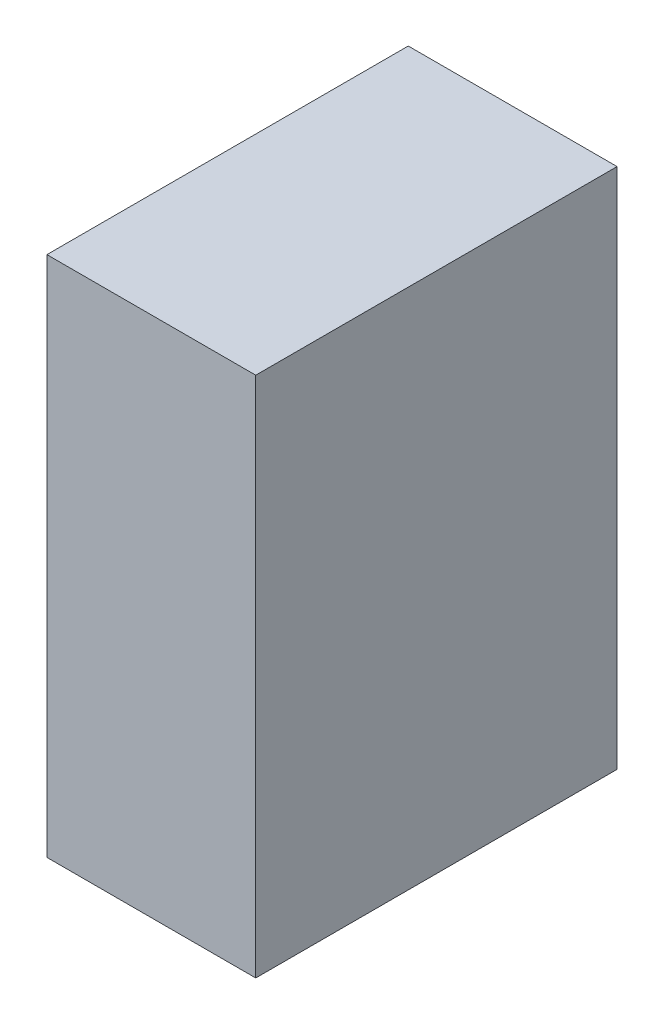
from build123d import *

# Parameters (mm, degrees)
SKETCH1_W           = 25.4
SKETCH1_H           = 63.5
BOSS_EXTRUDE1_DEPTH = 43.95


with BuildPart() as part:
    # Sketch1 → Boss-Extrude1 (new body)
    with BuildSketch(Plane.XY):
        Rectangle(SKETCH1_W, SKETCH1_H)
    extrude(amount=BOSS_EXTRUDE1_DEPTH)


solid = part.part
